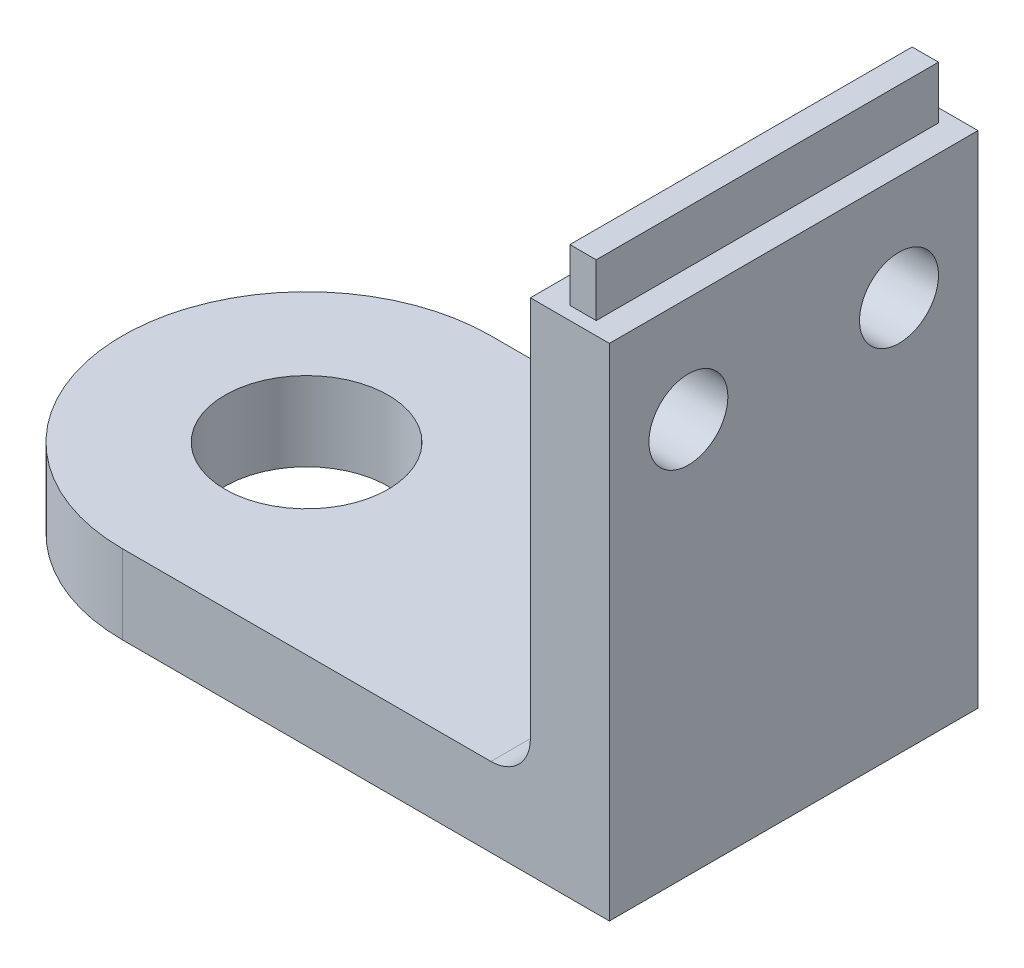
from build123d import *

# Parameters (mm, degrees)
BOSS_EXTRUDE1_DEPTH = 3
SKETCH2_W           = 3
SKETCH2_H           = 19
BOSS_EXTRUDE2_DEPTH = 7
SKETCH3_W           = 1
SKETCH3_H           = 13
BOSS_EXTRUDE3_DEPTH = 2
SKETCH4_R           = 3.1
CUT_EXTRUDE2_DEPTH  = 3
SKETCH5_R           = 1.5
CUT_EXTRUDE3_DEPTH  = 3
FILLET1_R           = 1.5


with BuildPart() as part:
    # Sketch1 → Boss-Extrude1 (new body)
    with BuildSketch(Plane(origin=(0, -19, 0), x_dir=(1, 0, 0), z_dir=(0, 1, 0))):
        with BuildLine():
            Line((5.5, -7), (24, -7))
            Line((24, -7), (24, 7))
            Line((24, 7), (5.5, 7))
            ThreePointArc((5.5, 7), (-1.5, 0), (5.5, -7))
        make_face()
    extrude(amount=BOSS_EXTRUDE1_DEPTH)

    # Sketch2 → Boss-Extrude2 (add, symmetric)
    with BuildSketch(Plane.XY):
        with Locations((22.5, -9.5)):
            Rectangle(SKETCH2_W, SKETCH2_H)
    extrude(amount=BOSS_EXTRUDE2_DEPTH, both=True)

    # Sketch3 → Boss-Extrude3 (add)
    with BuildSketch(Plane(origin=(0, 0, 0), x_dir=(1, 0, 0), z_dir=(0, 1, 0))):
        with Locations((22.5, 0)):
            Rectangle(SKETCH3_W, SKETCH3_H)
    extrude(amount=BOSS_EXTRUDE3_DEPTH)

    # Sketch4 → Cut-Extrude2 (cut)
    with BuildSketch(Plane(origin=(0, -19, 0), x_dir=(1, 0, 0), z_dir=(0, 1, 0))):
        with Locations(Location((5.5, 0, 0), (0, 0, 270))):
            Circle(SKETCH4_R)
    extrude(amount=CUT_EXTRUDE2_DEPTH, mode=Mode.SUBTRACT)

    # Sketch5 → Cut-Extrude3 (cut)
    with BuildSketch(Plane(origin=(24, 0, 0), x_dir=(0, 0, -1), z_dir=(1, 0, 0))):
        with Locations((-4, -4)):
            Circle(SKETCH5_R)
        with Locations((4, -4)):
            Circle(SKETCH5_R)
    extrude(amount=-CUT_EXTRUDE3_DEPTH, mode=Mode.SUBTRACT)

    # Fillet1
    fillet1_edges = [part.edges().sort_by_distance(p)[0] for p in [
        (21, -16, 0),
    ]]
    fillet(fillet1_edges, radius=FILLET1_R)


solid = part.part
